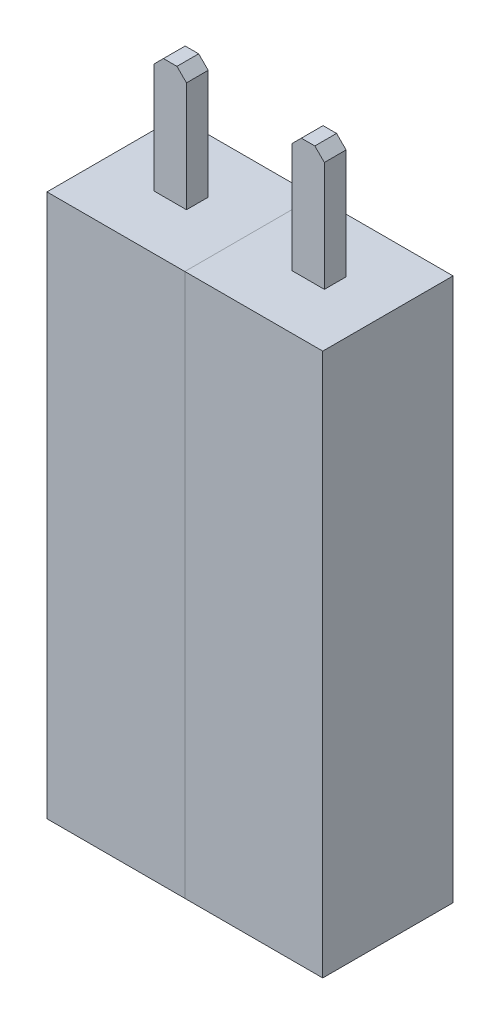
from build123d import *

# Parameters (mm, degrees)
SKETCH1_W           = 2.54
SKETCH1_H           = 10
BOSS_EXTRUDE1_DEPTH = 1.2
SKETCH2_W           = 1.2
SKETCH2_H           = 1.2
CUT_EXTRUDE1_DEPTH  = 7
BOSS_EXTRUDE2_DEPTH = 0.2
LPATTERN1_COUNT     = 2
LPATTERN1_PITCH     = 2.54


with BuildPart() as part:
    # Sketch1 → Boss-Extrude1 (new, symmetric)
    with BuildSketch(Plane.XY):
        Rectangle(SKETCH1_W, SKETCH1_H)
    extrude(amount=BOSS_EXTRUDE1_DEPTH, both=True)

    # Sketch2 → Cut-Extrude1 (cut)
    with BuildSketch(Plane.XZ.offset(5)):
        Rectangle(SKETCH2_W, SKETCH2_H)
    extrude(amount=-CUT_EXTRUDE1_DEPTH, mode=Mode.SUBTRACT)

    # Sketch3 → Boss-Extrude2 (add, symmetric)
    with BuildSketch(Plane.XY):
        Polygon((-0.3, 5), (-0.3, 7.024264069), (-0.124264069, 7.2), (0.124264069, 7.2), (0.3, 7.024264069), (0.3, 5), align=None)
    extrude(amount=BOSS_EXTRUDE2_DEPTH, both=True)


with BuildPart() as lpattern1_1:
    # LPattern1: pattern copy
    add(part.part.moved(Location(Vector(1, 0, 0) * (1 * LPATTERN1_PITCH))))


solid = Compound([part.part, lpattern1_1.part])
